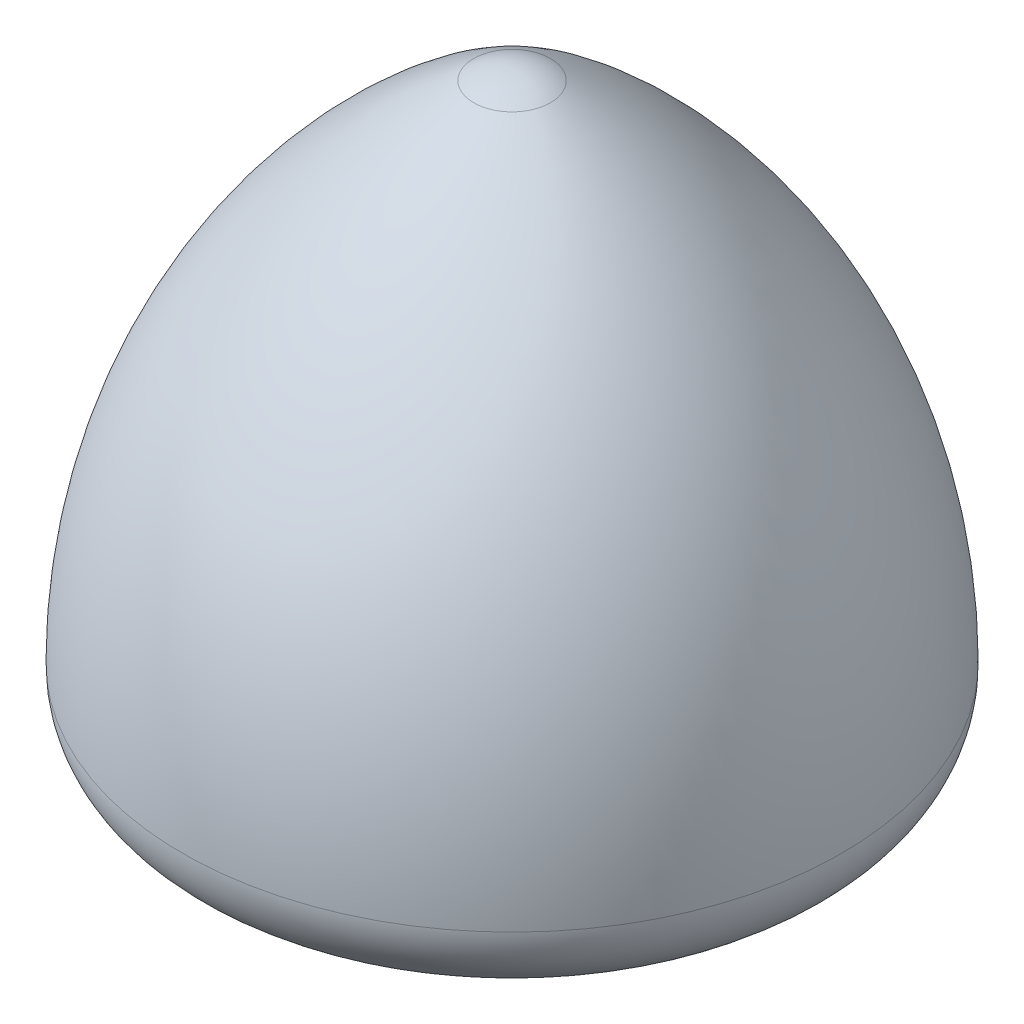
from build123d import *

# Parameters (mm, degrees)
SCALE1_SCALE = 0.5


with BuildPart() as part:
    # Sketch1 → Revolve1 (revolve)
    with BuildSketch(Plane.XY):
        with BuildLine():
            Line((0, 27.967342904), (0, -22.032657096))
            ThreePointArc((0, -22.032657096), (11.434937563, -20.527219006), (22.090603028, -16.113497855))
            ThreePointArc((22.090603028, -16.113497855), (24.220429431, -13.983671452), (25, -11.07427448))
            ThreePointArc((25, -11.07427448), (19.080840758, 11.016328548), (2.909396972, 27.187772335))
            ThreePointArc((2.909396972, 27.187772335), (1.506014692, 27.769072308), (0, 27.967342904))
        make_face()
    revolve(axis=Axis((0, 0, 0), (0, 1, 0)))


with BuildPart() as part_1:
    # Scale1: scaled about (0, -1.650487908, 0)
    add(part.part.scale(SCALE1_SCALE).moved(Location((0, -0.825243954, 0))))


solid = part_1.part
